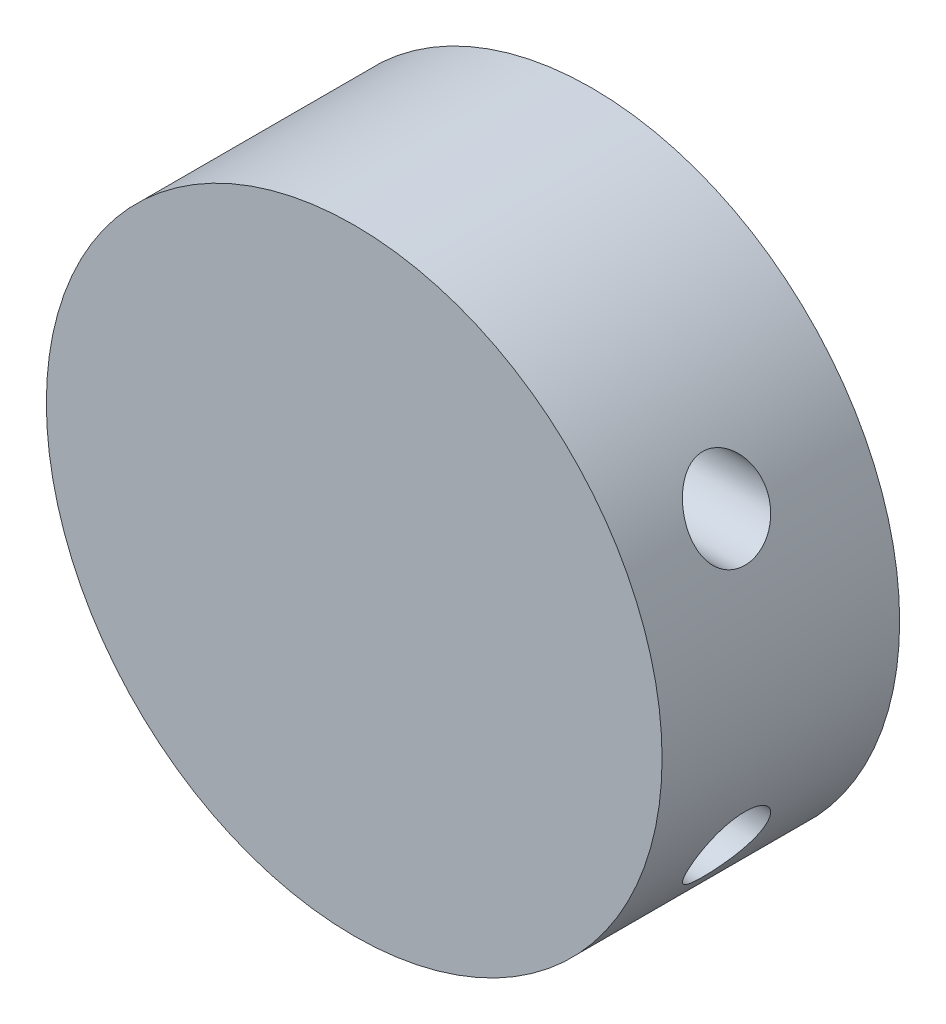
from build123d import *

# Parameters (mm, degrees)
SKIZZE1_R        = 31.75
LIDAR_BASE_DEPTH = 24.5
SKIZZE2_R        = 4
SENSOR_CUT_DEPTH = 66.470413165


with BuildPart() as part:
    # Skizze1 → Lidar Base (new body)
    with BuildSketch(Plane.XY):
        Circle(SKIZZE1_R)
    extrude(amount=LIDAR_BASE_DEPTH)

    # Skizze2 → Sensor Cut (cut, through all)
    with BuildSketch(Plane(origin=(20, 0, 0), x_dir=(0, 0, -1), z_dir=(1, 0, 0))):
        with Locations(Location((-14, 15, 0), (0, 0, 180))):
            Circle(SKIZZE2_R)
        with Locations(Location((-14, -15, 0), (0, 0, 180))):
            Circle(SKIZZE2_R)
    extrude(amount=SENSOR_CUT_DEPTH, mode=Mode.SUBTRACT)


solid = part.part
